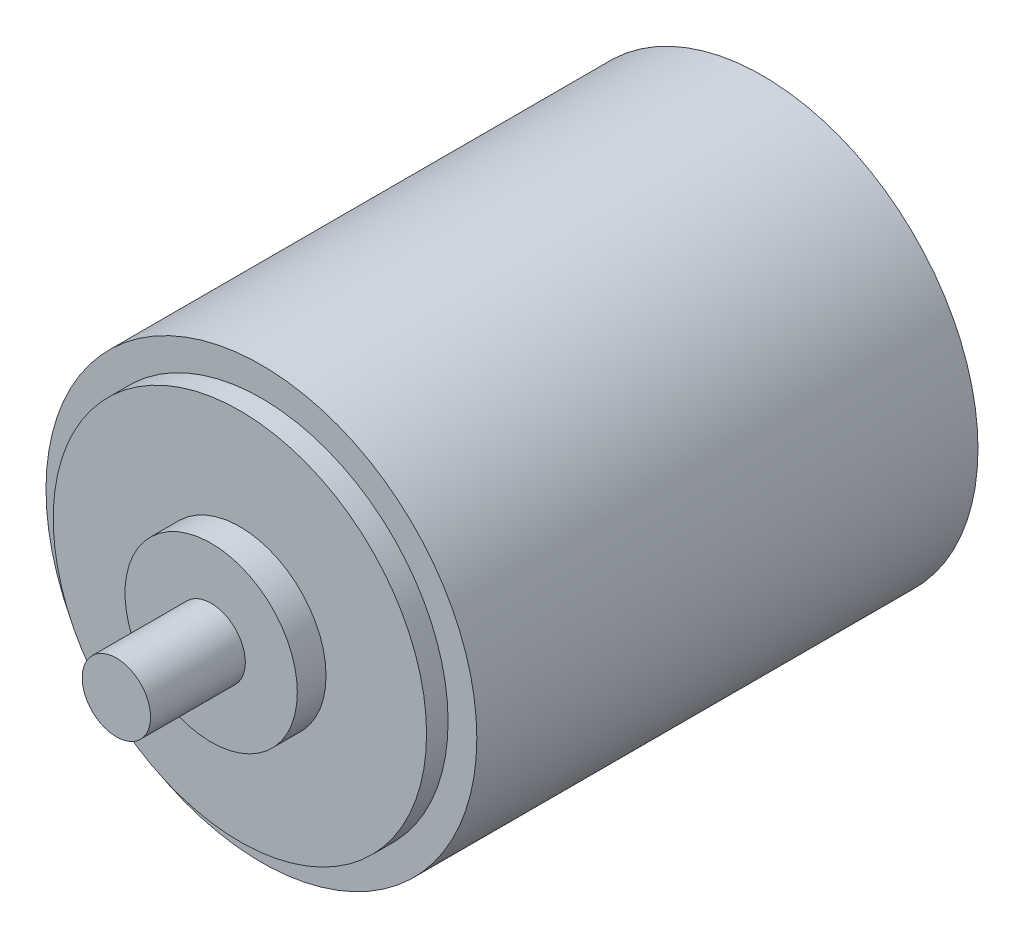
from build123d import *
from build123d.topology import SkipClean

# Parameters (mm, degrees)
ESQUISSE1_R        = 7.5
BOSS_EXTRU_1_DEPTH = 15.05
ESQUISSE3_R        = 6.5
BOSS_EXTRU_2_DEPTH = 0.75
ESQUISSE4_R        = 3
BOSS_EXTRU_3_DEPTH = 1
ESQUISSE5_R        = 1.19
BOSS_EXTRU_4_DEPTH = 3.3
BOSS_EXTRU_7_START = 2.4
BOSS_EXTRU_7_DEPTH = 2.4


with BuildPart() as part:
    # Esquisse1 → Boss.-Extru.1 (new body)
    with BuildSketch(Plane.XY):
        Circle(ESQUISSE1_R)
    extrude(amount=BOSS_EXTRU_1_DEPTH)

    # Esquisse3 → Boss.-Extru.2 (add)
    with BuildSketch(Plane.XY.offset(15.05)):
        Circle(ESQUISSE3_R)
    extrude(amount=BOSS_EXTRU_2_DEPTH)

    # Esquisse4 → Boss.-Extru.3 (add)
    with BuildSketch(Plane.XY.offset(15.8)):
        Circle(ESQUISSE4_R)
    extrude(amount=BOSS_EXTRU_3_DEPTH)

    # Esquisse5 → Boss.-Extru.4 (add)
    with BuildSketch(Plane.XY.offset(16.8)):
        Circle(ESQUISSE5_R)
    extrude(amount=BOSS_EXTRU_4_DEPTH)

    # Esquisse8 → Boss.-Extru.7 (add)
    with SkipClean():  # the faces are left unmerged after this step: merging them gives an invalid solid
        with BuildSketch(Plane(origin=(0, 0, 0), x_dir=(-1, 0, 0), z_dir=(0, 0, -1)).offset(BOSS_EXTRU_7_START)):
            with BuildLine():
                Line((-4.754997371, -5.8), (4.754997371, -5.8))
                ThreePointArc((4.754997371, -5.8), (0, 7.5), (-4.754997371, -5.8))
            make_face()
        extrude(amount=-BOSS_EXTRU_7_DEPTH)


solid = part.part
